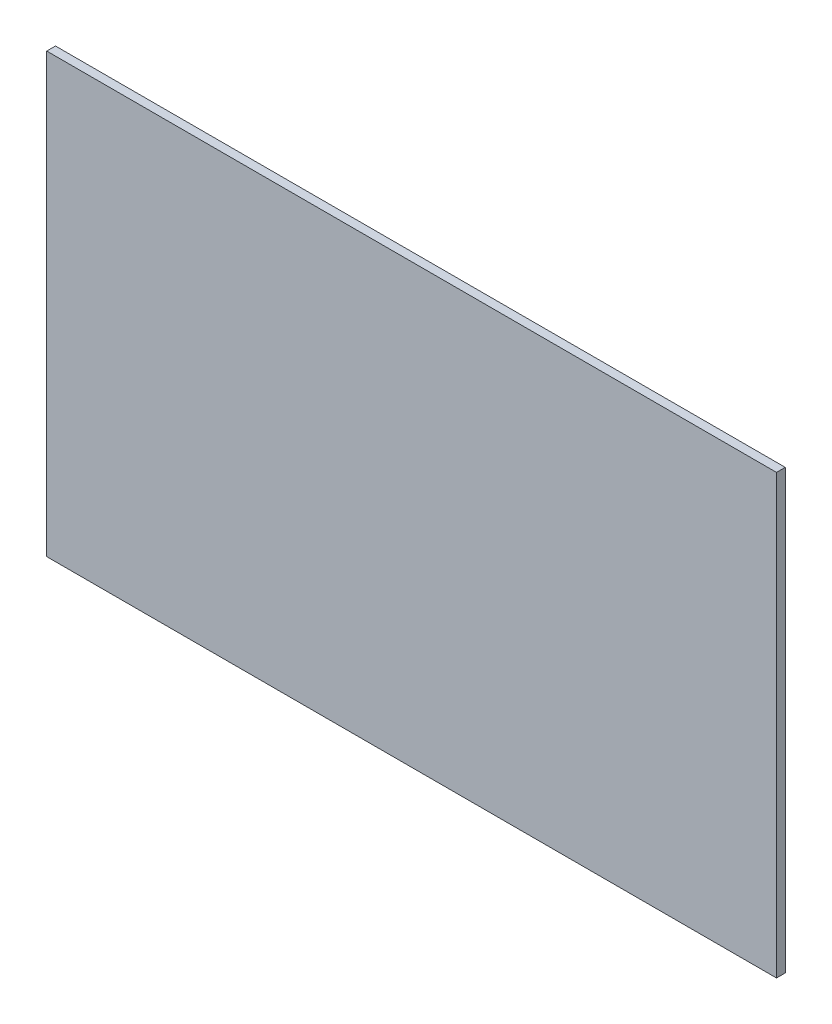
from build123d import *

# Parameters (mm, degrees)
SKETCH1_W           = 127
SKETCH1_H           = 76.2
BOSS_EXTRUDE1_DEPTH = 1.524


with BuildPart() as part:
    # Sketch1 → Boss-Extrude1 (new body)
    with BuildSketch(Plane.XY):
        Rectangle(SKETCH1_W, SKETCH1_H)
    extrude(amount=BOSS_EXTRUDE1_DEPTH)


solid = part.part
